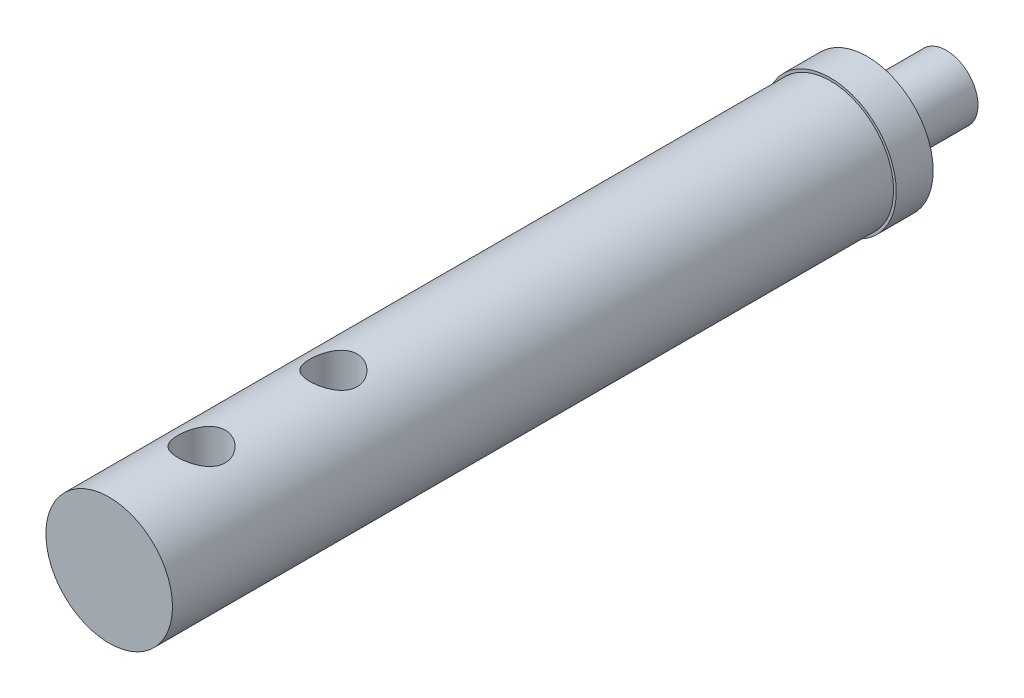
from build123d import *

# Parameters (mm, degrees)
SKETCH1_R           = 6
BOSS_EXTRUDE1_DEPTH = 15
SKETCH2_R           = 12.5
BOSS_EXTRUDE2_DEPTH = 7
SKETCH3_R           = 12
BOSS_EXTRUDE3_DEPTH = 136.7
SKETCH4_R           = 4.5
CUT_EXTRUDE1_DEPTH  = 160.681526796
LPATTERN1_COUNT     = 2
LPATTERN1_PITCH     = 25


with BuildPart() as part:
    # Sketch1 → Boss-Extrude1 (new body)
    with BuildSketch(Plane.XY):
        Circle(SKETCH1_R)
    extrude(amount=BOSS_EXTRUDE1_DEPTH)

    # Sketch2 → Boss-Extrude2 (add)
    with BuildSketch(Plane.XY.offset(15)):
        Circle(SKETCH2_R)
    extrude(amount=BOSS_EXTRUDE2_DEPTH)

    # Sketch3 → Boss-Extrude3 (add)
    with BuildSketch(Plane.XY.offset(22)):
        Circle(SKETCH3_R)
    extrude(amount=BOSS_EXTRUDE3_DEPTH)

    # Sketch4 → Cut-Extrude1 (cut, symmetric)
    with BuildSketch(Plane(origin=(0, 0, 0), x_dir=(1, 0, 0), z_dir=(0, 1, 0))):
        with Locations(Location((0, -141.2, 0), (0, 0, 270))):
            Circle(SKETCH4_R)
    cut_extrude1 = extrude(amount=CUT_EXTRUDE1_DEPTH, both=True, mode=Mode.SUBTRACT)

    # LPattern1: Cut-Extrude1 ×2
    with Locations(*[(0, 0, -i * LPATTERN1_PITCH) for i in range(1, LPATTERN1_COUNT)]):
        add(cut_extrude1, mode=Mode.SUBTRACT)


solid = part.part
